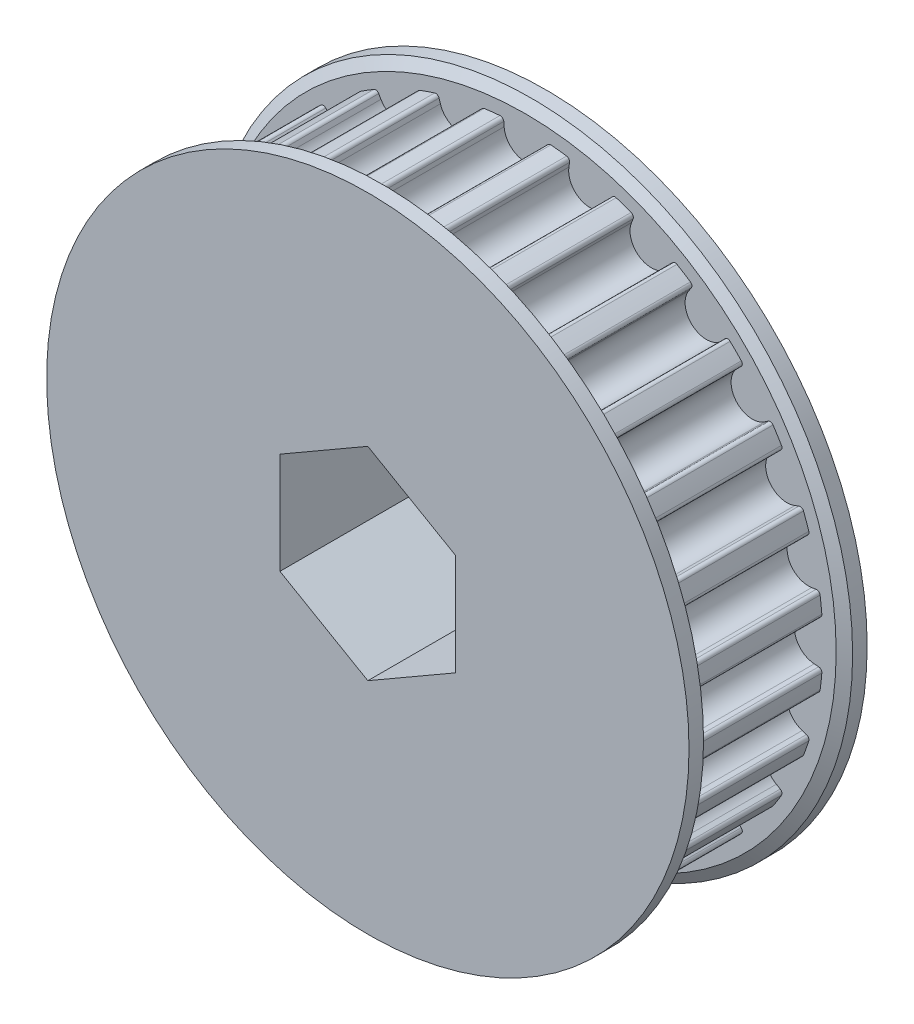
from build123d import *

# Parameters (mm, degrees)
SKETCH2_R               = 23.437392033
MAIN_BODY_DEPTH         = 5.000000033
TOOF_CUT_DEPTH          = 34.520481663
TOOF_PATTERN_COUNT      = 28
SKETCH3_R               = 23.437392033
FLANGE_DEPTH            = 1.5
CHAMFER1_SIZE           = 0.762
CHAMFER1_SIZE2          = 0.439940905
CUT_EXTRUDE1_DEPTH      = 34.776806999
CUT_EXTRUDE1_DEPTH_BACK = 34.776806999


with BuildPart() as part:
    # Sketch2 → Main Body (new body)
    with BuildSketch(Plane.XY):
        Circle(SKETCH2_R)
    extrude(amount=MAIN_BODY_DEPTH)

    # Sketch1 → Toof Cut (cut, through all)
    with BuildSketch(Plane.XY):
        with BuildLine():
            Line((2.430770277, 21.573682902), (2.62415532, 23.290022631))
            ThreePointArc((2.62415532, 23.290022631), (0, 23.437392033), (-2.62415532, 23.290022631))
            Line((-2.62415532, 23.290022631), (-2.430770277, 21.573682902))
            ThreePointArc((-2.430770277, 21.573682902), (-2.142920785, 21.60417387), (-1.854690354, 21.630824344))
            ThreePointArc((-1.854690354, 21.630824344), (-1.668239137, 21.571073205), (-1.579680693, 21.3964546))
            Line((-1.579680693, 21.3964546), (-1.55576573, 21.072531271))
            ThreePointArc((-1.55576573, 21.072531271), (0, 19.627392033), (1.55576573, 21.072531271))
            Line((1.55576573, 21.072531271), (1.579680693, 21.3964546))
            ThreePointArc((1.579680693, 21.3964546), (1.668239137, 21.571073205), (1.854690354, 21.630824344))
            ThreePointArc((1.854690354, 21.630824344), (2.142920785, 21.60417387), (2.430770277, 21.573682902))
        make_face()
    toof_cut = extrude(amount=TOOF_CUT_DEPTH, mode=Mode.SUBTRACT)

    # Toof Pattern: Toof Cut ×28 about axis
    toof_pattern_axis = Axis((0, 0, -4.950000019), (0, 0, 1))
    for i in range(1, TOOF_PATTERN_COUNT):
        add(toof_cut.rotate(toof_pattern_axis, i * 360 / TOOF_PATTERN_COUNT), mode=Mode.SUBTRACT)

    # Sketch3 → Flange' (add)
    with BuildSketch(Plane.XY.offset(5.000000033)):
        Circle(SKETCH3_R)
    extrude(amount=FLANGE_DEPTH)

    # Chamfer1
    chamfer1_edges = [part.edges().sort_by_distance(p)[0] for p in [
        (-23.437392033, 0, 5.000000033),
    ]]
    chamfer1_side = [part.faces().sort_by_distance(p)[0] for p in [
        (-22.774482479, 0, 5.000000033),
    ]]
    chamfer(chamfer1_edges, length=CHAMFER1_SIZE, length2=CHAMFER1_SIZE2, reference=chamfer1_side[0])

    # Mirror1: part across plane


with BuildPart() as part_1:
    add(part.part)
    add(part.part.mirror(Plane.XY))

    # Sketch4 → Cut-Extrude1 (cut, two sides: drawn at the far end of the back side and taken through both)
    with BuildSketch(Plane.XY.offset(-CUT_EXTRUDE1_DEPTH_BACK)):
        Polygon((6.4135, 3.702835951), (0, 7.405671903), (-6.4135, 3.702835951), (-6.4135, -3.702835951), (0, -7.405671903), (6.4135, -3.702835951), align=None)
    extrude(amount=CUT_EXTRUDE1_DEPTH + CUT_EXTRUDE1_DEPTH_BACK, mode=Mode.SUBTRACT)


solid = part_1.part
